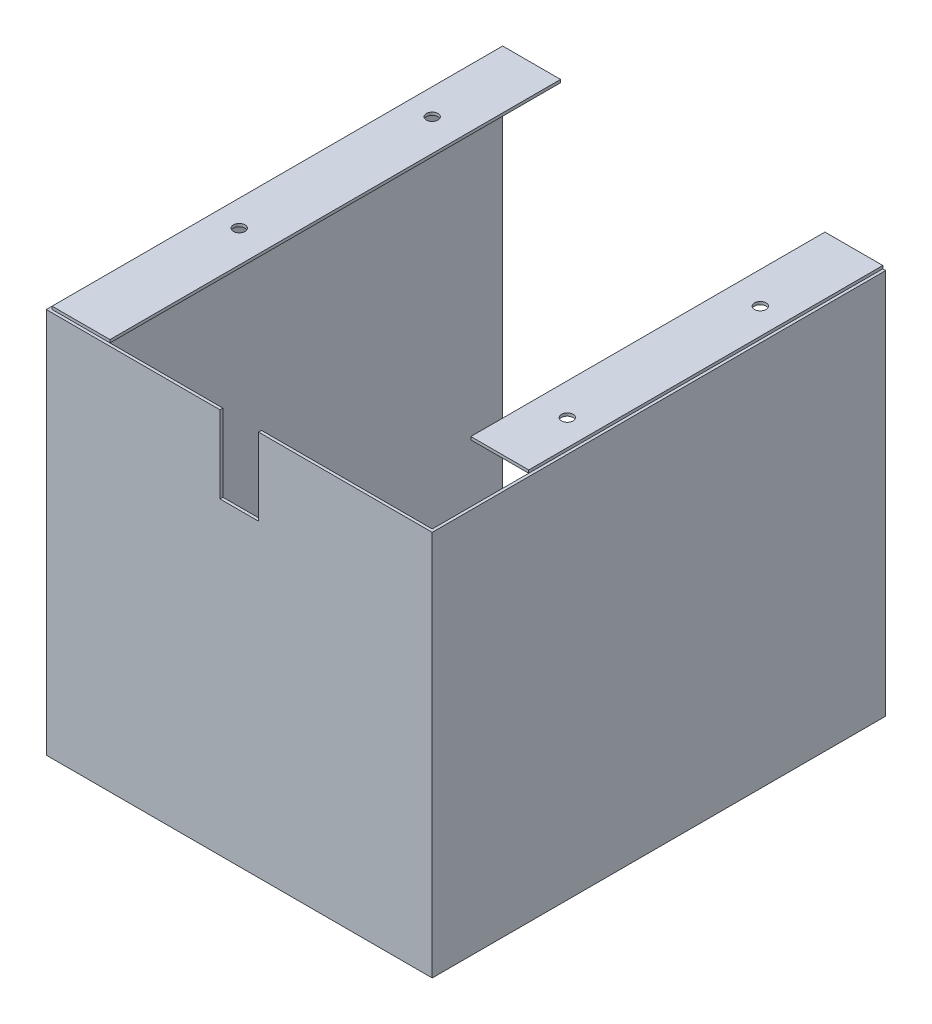
from build123d import *

# Parameters (mm, degrees)
SKETCH1_W             = 200
SKETCH1_H             = 200
BOSS_EXTRUDE1_DEPTH   = 235
SHELL1_T              = -1.5
CUT_EXTRUDE1_REACH    = 276.272
SKETCH2_W             = 20
SKETCH2_H             = 40
SKETCH3_W             = 30
SKETCH3_H             = 233.5
BOSS_EXTRUDE2_DEPTH   = 1.5
SKETCH3_H_2           = 183.5
BOSS_EXTRUDE2_2_DEPTH = 1.5
SKETCH5_R             = 3
CUT_EXTRUDE3_DEPTH    = 1.5


with BuildPart() as part:
    # Sketch1 → Boss-Extrude1 (new body)
    with BuildSketch(Plane.XY):
        Rectangle(SKETCH1_W, SKETCH1_H)
    extrude(amount=BOSS_EXTRUDE1_DEPTH)

    # Shell1
    shell1_openings = [part.faces().sort_by_distance(p)[0] for p in [
        (0, 0, 0),
        (0, 100, 117.5),
    ]]
    offset(amount=SHELL1_T, openings=shell1_openings, kind=Kind.INTERSECTION)

    # Sketch2 → Cut-Extrude1 (cut, up to next)
    with BuildSketch(Plane.XY.offset(235), mode=Mode.PRIVATE) as cut_extrude1_sk1:
        with Locations((0, 80)):
            Rectangle(SKETCH2_W, SKETCH2_H)
    cut_extrude1_tool1 = extrude(cut_extrude1_sk1.sketch, amount=-CUT_EXTRUDE1_REACH, mode=Mode.PRIVATE) & part.part
    add(cut_extrude1_tool1.solids().sort_by_distance((0, 80, 235))[0], mode=Mode.SUBTRACT)


with BuildPart() as body_2:
    # Sketch3 → Boss-Extrude2 (new body)
    with BuildSketch(Plane(origin=(0, 100, 0), x_dir=(1, 0, 0), z_dir=(0, 1, 0))):
        with Locations((-83.5, -116.75)):
            Rectangle(SKETCH3_W, SKETCH3_H)
    extrude(amount=BOSS_EXTRUDE2_DEPTH)


with BuildPart() as body_3:
    # Sketch3 → Boss-Extrude2 2 (new body)
    with BuildSketch(Plane(origin=(0, 100, 0), x_dir=(1, 0, 0), z_dir=(0, 1, 0))):
        with Locations((83.5, -91.75)):
            Rectangle(SKETCH3_W, SKETCH3_H_2)
    extrude(amount=BOSS_EXTRUDE2_2_DEPTH)


with BuildPart() as cut_extrude3_tool:
    # Sketch5 → Cut-Extrude3 (new body)
    with BuildSketch(Plane(origin=(0, 101.5, 0), x_dir=(1, 0, 0), z_dir=(0, 1, 0))):
        with Locations(Location((-85, -50, 0), (0, 0, 270))):
            Circle(SKETCH5_R)
        with Locations(Location((-85, -150, 0), (0, 0, 270))):
            Circle(SKETCH5_R)
        with Locations(Location((85, -150, 0), (0, 0, 90))):
            Circle(SKETCH5_R)
        with Locations(Location((85, -50, 0), (0, 0, 90))):
            Circle(SKETCH5_R)
    extrude(amount=-CUT_EXTRUDE3_DEPTH)


with BuildPart() as body_2_1:
    add(body_2.part)

    # Cut-Extrude3: cut by cut_extrude3_tool
    add(cut_extrude3_tool.part, mode=Mode.SUBTRACT)


with BuildPart() as body_3_1:
    add(body_3.part)

    # Cut-Extrude3: cut by cut_extrude3_tool
    add(cut_extrude3_tool.part, mode=Mode.SUBTRACT)


solid = Compound([part.part, body_2_1.part, body_3_1.part])
